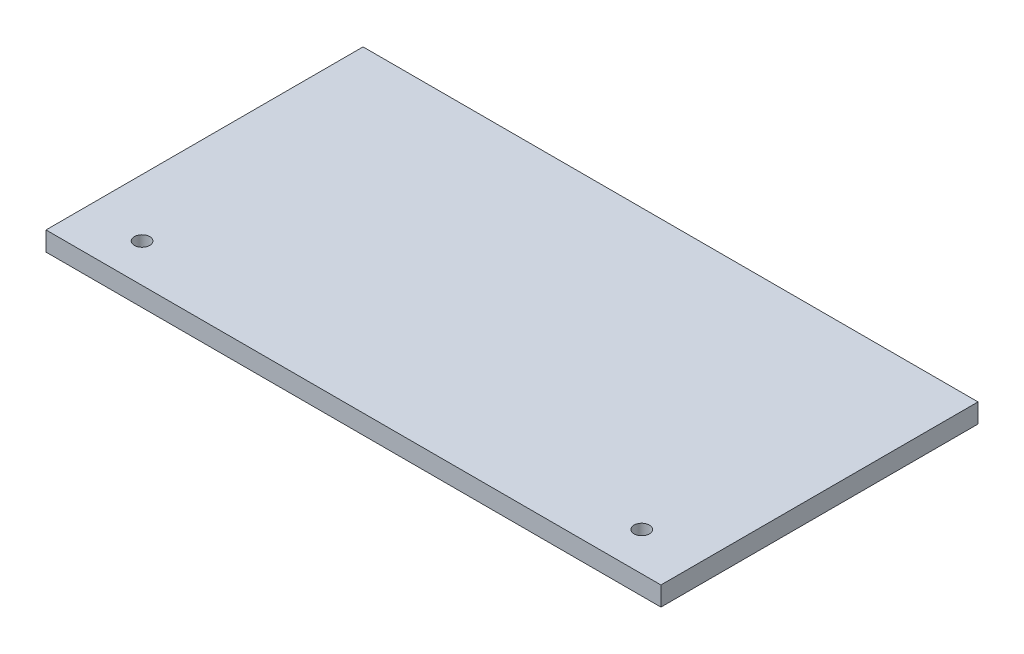
from build123d import *

# Parameters (mm, degrees)
SKETCH1_W               = 128
SKETCH1_H               = 66
SKETCH1_R               = 1.6
TRAY_BASE_EXTRUDE_DEPTH = 4


with BuildPart() as part:
    # Sketch1 → Tray_Base_Extrude (new body)
    with BuildSketch(Plane(origin=(0, 0, 0), x_dir=(1, 0, 0), z_dir=(0, 1, 0))):
        Rectangle(SKETCH1_W, SKETCH1_H)
        with Locations(Location((-52, -25, 0), (0, 0, 270))):
            Circle(SKETCH1_R, mode=Mode.SUBTRACT)
        with Locations(Location((52, -25, 0), (0, 0, 270))):
            Circle(SKETCH1_R, mode=Mode.SUBTRACT)
    extrude(amount=TRAY_BASE_EXTRUDE_DEPTH)


solid = part.part
